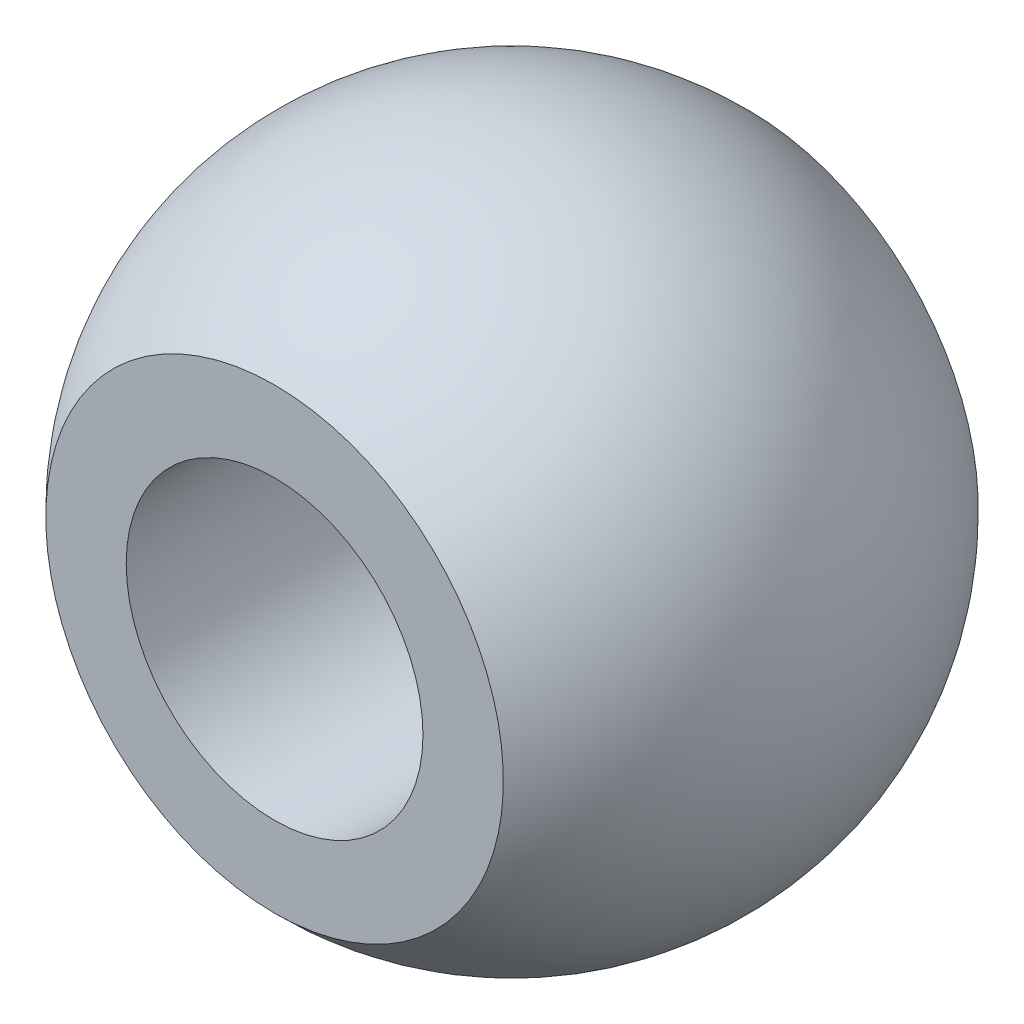
from build123d import *


with BuildPart() as part:
    # Sketch26 → Body-Joint (revolve)
    with BuildSketch(Plane(origin=(0, 0, 0), x_dir=(0, 0, -1), z_dir=(1, 0, 0))):
        with BuildLine():
            Line((4, 3.854610875), (4, 2.5))
            Line((4, 2.5), (-4, 2.5))
            Line((-4, 2.5), (-4, 3.854610875))
            ThreePointArc((-4, 3.854610875), (0, 5.555), (4, 3.854610875))
        make_face()
    revolve(axis=Axis((0, 0, 4), (0, 0, -1)))


solid = part.part
